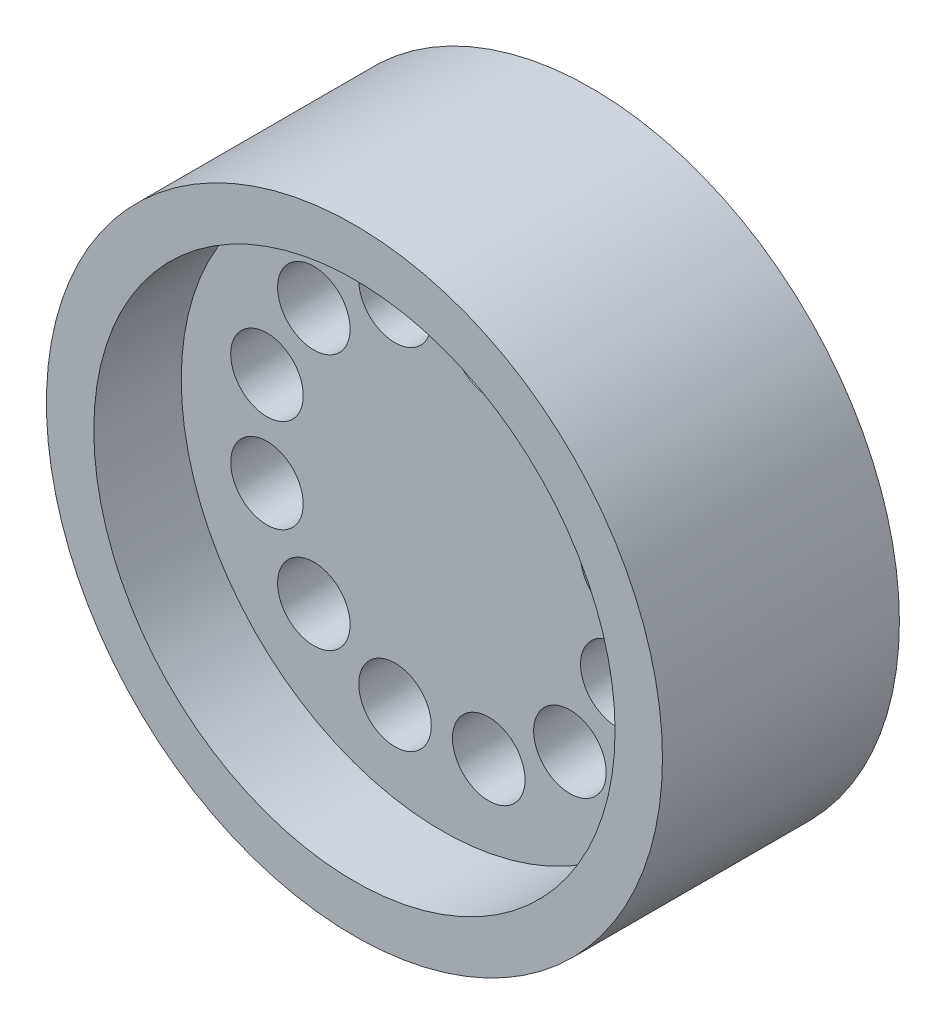
from build123d import *

# Parameters (mm, degrees)
SKETCH4_W           = 5.773195876
SKETCH4_H           = 27.5
SKETCH5_R           = 3.827192532
CUT_EXTRUDE1_DEPTH  = 10
SKETCH7_R           = 2.5
BOSS_EXTRUDE1_DEPTH = 30


with BuildPart() as part:
    # Sketch4 → Revolve3 (revolve)
    with BuildSketch(Plane(origin=(0, 0, 0), x_dir=(0, 0, -1), z_dir=(1, 0, 0)), mode=Mode.PRIVATE) as revolve3_sk:
        Polygon((-2.886597938, 13.75), (2.886597938, 13.75), (12.886597938, 13.75), (12.886597938, 18.75), (-12.113402062, 18.75), (-12.113402062, 13.75), align=None)
        Rectangle(SKETCH4_W, SKETCH4_H)
    revolve(revolve3_sk.sketch.rotate(Axis((0, -13.75, 14.432989691), (0, 0, -1)), 90), axis=Axis((0, -13.75, 14.432989691), (0, 0, -1)))

    # Sketch5 → Cut-Extrude1 (cut)
    with BuildSketch(Plane(origin=(0, 0, -2.886597938), x_dir=(-1, 0, 0), z_dir=(0, 0, -1))):
        with Locations((4.945213264, 4.705787154)):
            Circle(SKETCH5_R)
        with Locations(Location((13.51057389, -0.23942611, 0), (0, 0, 180))):
            Circle(SKETCH5_R)
        with Locations((18.455787154, -8.804786736)):
            Circle(SKETCH5_R)
        with Locations(Location((18.455787154, -18.695213264, 0), (0, 0, 180))):
            Circle(SKETCH5_R)
        with Locations((13.51057389, -27.26057389)):
            Circle(SKETCH5_R)
        with Locations(Location((4.945213264, -32.205787154, 0), (0, 0, 180))):
            Circle(SKETCH5_R)
        with Locations((-4.945213264, -32.205787154)):
            Circle(SKETCH5_R)
        with Locations(Location((-13.51057389, -27.26057389, 0), (0, 0, 180))):
            Circle(SKETCH5_R)
        with Locations((-18.455787154, -18.695213264)):
            Circle(SKETCH5_R)
        with Locations(Location((-18.455787154, -8.804786736, 0), (0, 0, 180))):
            Circle(SKETCH5_R)
        with Locations((-13.51057389, -0.23942611)):
            Circle(SKETCH5_R)
        with Locations(Location((-4.945213264, 4.705787154, 0), (0, 0, 180))):
            Circle(SKETCH5_R)
    extrude(amount=-CUT_EXTRUDE1_DEPTH, mode=Mode.SUBTRACT)

    # Sketch7 → Boss-Extrude1 (add)
    with BuildSketch(Plane(origin=(0, 0, -2.886597938), x_dir=(-1, 0, 0), z_dir=(0, 0, -1))):
        with Locations(Location((0, -13.75, 0), (0, 0, 180))):
            Circle(SKETCH7_R)
    extrude(amount=BOSS_EXTRUDE1_DEPTH)


solid = part.part
